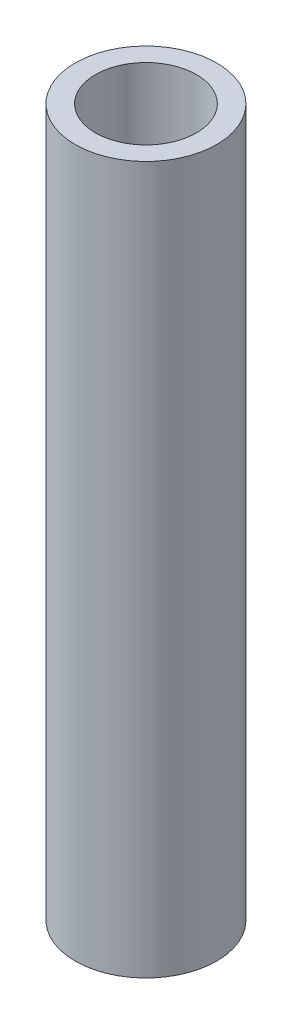
from build123d import *

# Parameters (mm, degrees)
SKETCH_1_R      = 3.5
SKETCH_1_R_2    = 2.5
EXTRUDE_1_DEPTH = 35


with BuildPart() as part:
    # 草图1 → 凸台-拉伸1 (new body)
    with BuildSketch(Plane(origin=(0, 0, 0), x_dir=(1, 0, 0), z_dir=(0, 1, 0))):
        with Locations(Location((0, 0, 0), (0, 0, 270))):
            Circle(SKETCH_1_R)
        with Locations(Location((0, 0, 0), (0, 0, 270))):
            Circle(SKETCH_1_R_2, mode=Mode.SUBTRACT)
    extrude(amount=EXTRUDE_1_DEPTH)


solid = part.part
